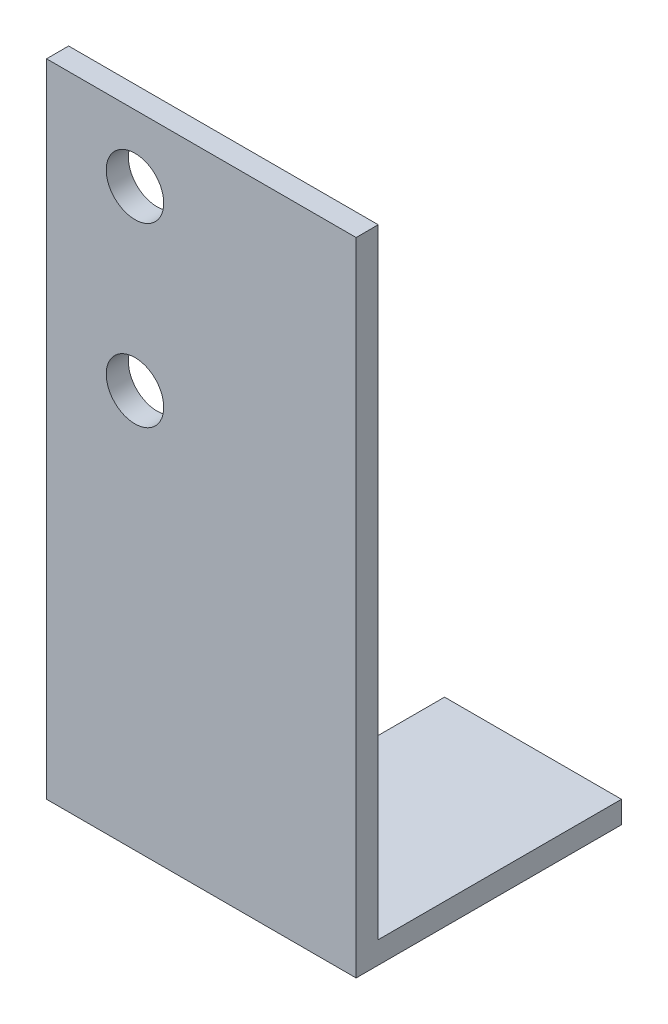
from build123d import *

# Parameters (mm, degrees)
EXTRUDE_1_DEPTH     = 14
SKETCH_2_R          = 1.3
CUT_EXTRUDE_1_DEPTH = 35.365680555
SKETCH_4_W          = 6
SKETCH_4_H          = 11
CUT_EXTRUDE_3_DEPTH = 34.526109228


with BuildPart() as part:
    # 草圖1 → 填料-伸長1 (new body)
    with BuildSketch(Plane(origin=(0, 0, 0), x_dir=(0, 0, -1), z_dir=(1, 0, 0))):
        Polygon((0, 0), (12, 0), (12, 1), (1, 1), (1, 29), (0, 29), align=None)
    extrude(amount=EXTRUDE_1_DEPTH)

    # 草圖2 → 除料-伸長1 (cut, through all)
    with BuildSketch(Plane.XY):
        with Locations((4, 26)):
            Circle(SKETCH_2_R)
        with Locations((4, 18)):
            Circle(SKETCH_2_R)
    extrude(amount=-CUT_EXTRUDE_1_DEPTH, mode=Mode.SUBTRACT)

    # 草圖4 → 除料-伸長3 (cut, through all)
    with BuildSketch(Plane(origin=(0, 1, 0), x_dir=(1, 0, 0), z_dir=(0, 1, 0))):
        with Locations((3, 6.5)):
            Rectangle(SKETCH_4_W, SKETCH_4_H)
    extrude(amount=-CUT_EXTRUDE_3_DEPTH, mode=Mode.SUBTRACT)


solid = part.part
